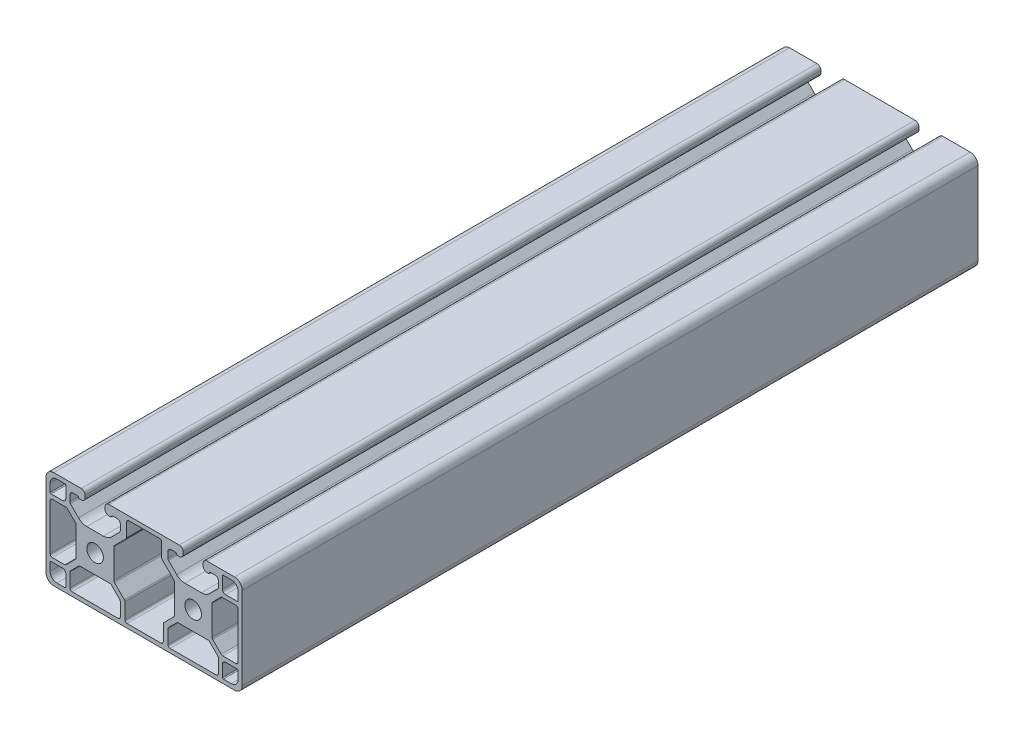
from build123d import *

# Parameters (mm, degrees)
SKETCH1_R      = 3.377777778
EXTRUDE1_DEPTH = 300


with BuildPart() as part:
    # Sketch1 → Extrude1 (new body)
    with BuildSketch(Plane.XY):
        with BuildLine():
            Line((20, -16.825396825), (20, 16.825396825))
            ThreePointArc((20, 16.825396825), (19.070180258, 19.070180258), (16.825396825, 20))
            Line((16.825396825, 20), (5.638095238, 20))
            ThreePointArc((5.638095238, 20), (4.524682656, 19.538809408), (4.063492063, 18.425396825))
            Line((4.063492063, 18.425396825), (4.063492063, 17.511111111))
            ThreePointArc((4.063492063, 17.511111111), (4.524682656, 16.397698529), (5.638095238, 15.936507937))
            Line((5.638095238, 15.936507937), (6.344572699, 15.936507937))
            ThreePointArc((6.344572699, 15.936507937), (6.608509887, 16.043145483), (6.724293748, 16.303200291))
            Line((6.724293748, 16.303200291), (6.72528969, 16.331720344))
            ThreePointArc((6.72528969, 16.331720344), (6.84107355, 16.591775152), (7.105010739, 16.698412698))
            Line((7.105010739, 16.698412698), (9.015873016, 16.698412698))
            ThreePointArc((9.015873016, 16.698412698), (9.913786389, 16.326484802), (10.285714286, 15.428571429))
            Line((10.285714286, 15.428571429), (10.285714286, 12.988478889))
            ThreePointArc((10.285714286, 12.988478889), (10.218051648, 12.648315838), (10.025364758, 12.359939528))
            Line((10.025364758, 12.359939528), (6.738975247, 9.073550017))
            ThreePointArc((6.738975247, 9.073550017), (5.198221819, 8.04405149), (3.380779233, 7.682539683))
            Line((3.380779233, 7.682539683), (-3.380779233, 7.682539683))
            ThreePointArc((-3.380779233, 7.682539683), (-5.198221819, 8.04405149), (-6.738975247, 9.073550017))
            Line((-6.738975247, 9.073550017), (-10.025364758, 12.359939528))
            ThreePointArc((-10.025364758, 12.359939528), (-10.218051648, 12.648315838), (-10.285714286, 12.988478889))
            Line((-10.285714286, 12.988478889), (-10.285714286, 15.428571429))
            ThreePointArc((-10.285714286, 15.428571429), (-9.913786389, 16.326484802), (-9.015873016, 16.698412698))
            Line((-9.015873016, 16.698412698), (-7.105010739, 16.698412698))
            ThreePointArc((-7.105010739, 16.698412698), (-6.84107355, 16.591775152), (-6.72528969, 16.331720344))
            Line((-6.72528969, 16.331720344), (-6.724293748, 16.303200291))
            ThreePointArc((-6.724293748, 16.303200291), (-6.608509887, 16.043145483), (-6.344572699, 15.936507937))
            Line((-6.344572699, 15.936507937), (-5.638095238, 15.936507937))
            ThreePointArc((-5.638095238, 15.936507937), (-4.524682656, 16.397698529), (-4.063492063, 17.511111111))
            Line((-4.063492063, 17.511111111), (-4.063492063, 18.425396825))
            ThreePointArc((-4.063492063, 18.425396825), (-4.524682656, 19.538809408), (-5.638095238, 20))
            Line((-5.638095238, 20), (-34.361904762, 20))
            ThreePointArc((-34.361904762, 20), (-35.475317344, 19.538809408), (-35.936507937, 18.425396825))
            Line((-35.936507937, 18.425396825), (-35.936507937, 17.511111111))
            ThreePointArc((-35.936507937, 17.511111111), (-35.475317344, 16.397698529), (-34.361904762, 15.936507937))
            Line((-34.361904762, 15.936507937), (-33.655427301, 15.936507937))
            ThreePointArc((-33.655427301, 15.936507937), (-33.391490113, 16.043145483), (-33.275706252, 16.303200291))
            Line((-33.275706252, 16.303200291), (-33.27471031, 16.331720344))
            ThreePointArc((-33.27471031, 16.331720344), (-33.15892645, 16.591775152), (-32.894989261, 16.698412698))
            Line((-32.894989261, 16.698412698), (-30.984126984, 16.698412698))
            ThreePointArc((-30.984126984, 16.698412698), (-30.086213611, 16.326484802), (-29.714285714, 15.428571429))
            Line((-29.714285714, 15.428571429), (-29.714285714, 12.988478889))
            ThreePointArc((-29.714285714, 12.988478889), (-29.781948352, 12.648315838), (-29.974635242, 12.359939528))
            Line((-29.974635242, 12.359939528), (-33.261024753, 9.073550017))
            ThreePointArc((-33.261024753, 9.073550017), (-34.801778181, 8.04405149), (-36.619220767, 7.682539683))
            Line((-36.619220767, 7.682539683), (-43.380779233, 7.682539683))
            ThreePointArc((-43.380779233, 7.682539683), (-45.198221819, 8.04405149), (-46.738975247, 9.073550017))
            Line((-46.738975247, 9.073550017), (-50.025364758, 12.359939528))
            ThreePointArc((-50.025364758, 12.359939528), (-50.218051648, 12.648315838), (-50.285714286, 12.988478889))
            Line((-50.285714286, 12.988478889), (-50.285714286, 15.428571429))
            ThreePointArc((-50.285714286, 15.428571429), (-49.913786389, 16.326484802), (-49.015873016, 16.698412698))
            Line((-49.015873016, 16.698412698), (-47.105010739, 16.698412698))
            ThreePointArc((-47.105010739, 16.698412698), (-46.84107355, 16.591775152), (-46.72528969, 16.331720344))
            Line((-46.72528969, 16.331720344), (-46.724293748, 16.303200291))
            ThreePointArc((-46.724293748, 16.303200291), (-46.608509887, 16.043145483), (-46.344572699, 15.936507937))
            Line((-46.344572699, 15.936507937), (-45.638095238, 15.936507937))
            ThreePointArc((-45.638095238, 15.936507937), (-44.524682656, 16.397698529), (-44.063492063, 17.511111111))
            Line((-44.063492063, 17.511111111), (-44.063492063, 18.425396825))
            ThreePointArc((-44.063492063, 18.425396825), (-44.524682656, 19.538809408), (-45.638095238, 20))
            Line((-45.638095238, 20), (-56.825396825, 20))
            ThreePointArc((-56.825396825, 20), (-59.070180258, 19.070180258), (-60, 16.825396825))
            Line((-60, 16.825396825), (-60, -16.825396825))
            ThreePointArc((-60, -16.825396825), (-59.070180258, -19.070180258), (-56.825396825, -20))
            Line((-56.825396825, -20), (16.825396825, -20))
            ThreePointArc((16.825396825, -20), (19.070180258, -19.070180258), (20, -16.825396825))
        make_face()
        Circle(SKETCH1_R, mode=Mode.SUBTRACT)
        with Locations((-40, 0)):
            Circle(SKETCH1_R, mode=Mode.SUBTRACT)
        with BuildLine():
            Line((18.349206349, 15.555555556), (18.314527251, 12.312397841))
            ThreePointArc((18.314527251, 12.312397841), (18.201823251, 12.046360922), (17.934596465, 11.936507937))
            Line((17.934596465, 11.936507937), (13.206349206, 11.936507937))
            ThreePointArc((13.206349206, 11.936507937), (12.308435833, 12.308435833), (11.936507937, 13.206349206))
            Line((11.936507937, 13.206349206), (11.936507937, 17.934596465))
            ThreePointArc((11.936507937, 17.934596465), (12.046360922, 18.201823251), (12.312397841, 18.31452725))
            Line((12.312397841, 18.31452725), (15.555555556, 18.349206349))
            ThreePointArc((15.555555556, 18.349206349), (17.530964976, 17.530964976), (18.349206349, 15.555555556))
        make_face(mode=Mode.SUBTRACT)
        with BuildLine():
            Line((15.555555556, -18.349206349), (12.316460442, -18.349206349))
            ThreePointArc((12.316460442, -18.349206349), (12.047793449, -18.237920837), (11.936507937, -17.969253843))
            Line((11.936507937, -17.969253843), (11.936507937, -13.206349206))
            ThreePointArc((11.936507937, -13.206349206), (12.308435833, -12.308435833), (13.206349206, -11.936507937))
            Line((13.206349206, -11.936507937), (17.934596465, -11.936507937))
            ThreePointArc((17.934596465, -11.936507937), (18.201823251, -12.046360922), (18.314527251, -12.312397841))
            Line((18.314527251, -12.312397841), (18.349206349, -15.555555556))
            ThreePointArc((18.349206349, -15.555555556), (17.530964976, -17.530964976), (15.555555556, -18.349206349))
        make_face(mode=Mode.SUBTRACT)
        with BuildLine():
            Line((-12.565047298, 11.307968575), (-7.94288921, 6.685810488))
            ThreePointArc((-7.94288921, 6.685810488), (-7.75020232, 6.397434178), (-7.682539683, 6.057271127))
            Line((-7.682539683, 6.057271127), (-7.682539683, -5.877688453))
            ThreePointArc((-7.682539683, -5.877688453), (-7.75020232, -6.217851504), (-7.94288921, -6.506227814))
            Line((-7.94288921, -6.506227814), (-11.930126663, -10.493465266))
            ThreePointArc((-11.930126663, -10.493465266), (-12.122813553, -10.781841576), (-12.19047619, -11.122004627))
            Line((-12.19047619, -11.122004627), (-12.19047619, -17.46031746))
            ThreePointArc((-12.19047619, -17.46031746), (-12.450825718, -18.088856821), (-13.079365079, -18.349206349))
            Line((-13.079365079, -18.349206349), (-26.920634921, -18.349206349))
            ThreePointArc((-26.920634921, -18.349206349), (-27.549174282, -18.088856821), (-27.80952381, -17.46031746))
            Line((-27.80952381, -17.46031746), (-27.80952381, -11.122004627))
            ThreePointArc((-27.80952381, -11.122004627), (-27.877186447, -10.781841576), (-28.069873337, -10.493465266))
            Line((-28.069873337, -10.493465266), (-32.05711079, -6.506227814))
            ThreePointArc((-32.05711079, -6.506227814), (-32.24979768, -6.217851504), (-32.317460317, -5.877688453))
            Line((-32.317460317, -5.877688453), (-32.317460317, 6.057271127))
            ThreePointArc((-32.317460317, 6.057271127), (-32.24979768, 6.397434178), (-32.05711079, 6.685810488))
            Line((-32.05711079, 6.685810488), (-27.434952702, 11.307968575))
            ThreePointArc((-27.434952702, 11.307968575), (-27.242265812, 11.596344886), (-27.174603175, 11.936507937))
            Line((-27.174603175, 11.936507937), (-27.174603175, 17.421618969))
            ThreePointArc((-27.174603175, 17.421618969), (-26.914253647, 18.05015833), (-26.285714286, 18.310507858))
            Line((-26.285714286, 18.310507858), (-13.714285714, 18.310507858))
            ThreePointArc((-13.714285714, 18.310507858), (-13.085746353, 18.05015833), (-12.825396825, 17.421618969))
            Line((-12.825396825, 17.421618969), (-12.825396825, 11.936507937))
            ThreePointArc((-12.825396825, 11.936507937), (-12.757734188, 11.596344886), (-12.565047298, 11.307968575))
        make_face(mode=Mode.SUBTRACT)
        with BuildLine():
            Line((-51.28244348, 10.025364758), (-47.94288921, 6.685810488))
            ThreePointArc((-47.94288921, 6.685810488), (-47.75020232, 6.397434178), (-47.682539683, 6.057271127))
            Line((-47.682539683, 6.057271127), (-47.682539683, -5.518523103))
            ThreePointArc((-47.682539683, -5.518523103), (-47.75020232, -5.858686154), (-47.94288921, -6.147062465))
            Line((-47.94288921, -6.147062465), (-51.821191504, -10.025364758))
            ThreePointArc((-51.821191504, -10.025364758), (-52.109567814, -10.218051648), (-52.449730865, -10.285714286))
            Line((-52.449730865, -10.285714286), (-57.421618969, -10.285714286))
            ThreePointArc((-57.421618969, -10.285714286), (-58.05015833, -10.025364758), (-58.310507858, -9.396825397))
            Line((-58.310507858, -9.396825397), (-58.310507858, 9.396825397))
            ThreePointArc((-58.310507858, 9.396825397), (-58.05015833, 10.025364758), (-57.421618969, 10.285714286))
            Line((-57.421618969, 10.285714286), (-51.910982841, 10.285714286))
            ThreePointArc((-51.910982841, 10.285714286), (-51.57081979, 10.218051648), (-51.28244348, 10.025364758))
        make_face(mode=Mode.SUBTRACT)
        with BuildLine():
            Line((-58.314527251, 12.312397841), (-58.349206349, 15.555555556))
            ThreePointArc((-58.349206349, 15.555555556), (-57.530964976, 17.530964976), (-55.555555556, 18.349206349))
            Line((-55.555555556, 18.349206349), (-52.312397841, 18.31452725))
            ThreePointArc((-52.312397841, 18.31452725), (-52.046360922, 18.201823251), (-51.936507937, 17.934596465))
            Line((-51.936507937, 17.934596465), (-51.936507937, 13.206349206))
            ThreePointArc((-51.936507937, 13.206349206), (-52.308435833, 12.308435833), (-53.206349206, 11.936507937))
            Line((-53.206349206, 11.936507937), (-57.934596465, 11.936507937))
            ThreePointArc((-57.934596465, 11.936507937), (-58.201823251, 12.046360922), (-58.314527251, 12.312397841))
        make_face(mode=Mode.SUBTRACT)
        with BuildLine():
            Line((-52.316460442, -18.349206349), (-55.555555556, -18.349206349))
            ThreePointArc((-55.555555556, -18.349206349), (-57.530964976, -17.530964976), (-58.349206349, -15.555555556))
            Line((-58.349206349, -15.555555556), (-58.314527251, -12.312397841))
            ThreePointArc((-58.314527251, -12.312397841), (-58.201823251, -12.046360922), (-57.934596465, -11.936507937))
            Line((-57.934596465, -11.936507937), (-53.206349206, -11.936507937))
            ThreePointArc((-53.206349206, -11.936507937), (-52.308435833, -12.308435833), (-51.936507937, -13.206349206))
            Line((-51.936507937, -13.206349206), (-51.936507937, -17.969253843))
            ThreePointArc((-51.936507937, -17.969253843), (-52.047793449, -18.237920837), (-52.316460442, -18.349206349))
        make_face(mode=Mode.SUBTRACT)
        with BuildLine():
            Line((-46.057271127, -7.682539683), (-33.942728873, -7.682539683))
            ThreePointArc((-33.942728873, -7.682539683), (-33.602565822, -7.75020232), (-33.314189512, -7.94288921))
            Line((-33.314189512, -7.94288921), (-29.974635242, -11.28244348))
            ThreePointArc((-29.974635242, -11.28244348), (-29.781948352, -11.57081979), (-29.714285714, -11.910982841))
            Line((-29.714285714, -11.910982841), (-29.714285714, -17.46031746))
            ThreePointArc((-29.714285714, -17.46031746), (-29.974635242, -18.088856821), (-30.603174603, -18.349206349))
            Line((-30.603174603, -18.349206349), (-49.396825397, -18.349206349))
            ThreePointArc((-49.396825397, -18.349206349), (-50.025364758, -18.088856821), (-50.285714286, -17.46031746))
            Line((-50.285714286, -17.46031746), (-50.285714286, -11.910982841))
            ThreePointArc((-50.285714286, -11.910982841), (-50.218051648, -11.57081979), (-50.025364758, -11.28244348))
            Line((-50.025364758, -11.28244348), (-46.685810488, -7.94288921))
            ThreePointArc((-46.685810488, -7.94288921), (-46.397434178, -7.75020232), (-46.057271127, -7.682539683))
        make_face(mode=Mode.SUBTRACT)
        with BuildLine():
            Line((10.285714286, -11.911028865), (10.285714286, -17.46031746))
            ThreePointArc((10.285714286, -17.46031746), (10.025364758, -18.088856821), (9.396825397, -18.349206349))
            Line((9.396825397, -18.349206349), (-9.396825397, -18.349206349))
            ThreePointArc((-9.396825397, -18.349206349), (-10.025364758, -18.088856821), (-10.285714286, -17.46031746))
            Line((-10.285714286, -17.46031746), (-10.285714286, -11.910982841))
            ThreePointArc((-10.285714286, -11.910982841), (-10.218051648, -11.57081979), (-10.025364758, -11.28244348))
            Line((-10.025364758, -11.28244348), (-6.685810488, -7.94288921))
            ThreePointArc((-6.685810488, -7.94288921), (-6.397434178, -7.75020232), (-6.057271127, -7.682539683))
            Line((-6.057271127, -7.682539683), (6.057225103, -7.682539683))
            ThreePointArc((6.057225103, -7.682539683), (6.397430675, -7.750210778), (6.685843032, -7.942921754))
            Line((6.685843032, -7.942921754), (10.025332214, -11.282410936))
            ThreePointArc((10.025332214, -11.282410936), (10.21804319, -11.570823293), (10.285714286, -11.911028865))
        make_face(mode=Mode.SUBTRACT)
        with BuildLine():
            Line((11.461993611, -10.025332214), (7.942921754, -6.506260357))
            ThreePointArc((7.942921754, -6.506260357), (7.750210778, -6.217848), (7.682539683, -5.877642429))
            Line((7.682539683, -5.877642429), (7.682539683, 6.057271127))
            ThreePointArc((7.682539683, 6.057271127), (7.75020232, 6.397434178), (7.94288921, 6.685810488))
            Line((7.94288921, 6.685810488), (11.28244348, 10.025364758))
            ThreePointArc((11.28244348, 10.025364758), (11.57081979, 10.218051648), (11.910982841, 10.285714286))
            Line((11.910982841, 10.285714286), (17.421618969, 10.285714286))
            ThreePointArc((17.421618969, 10.285714286), (18.05015833, 10.025364758), (18.310507858, 9.396825397))
            Line((18.310507858, 9.396825397), (18.310507858, -9.396825397))
            ThreePointArc((18.310507858, -9.396825397), (18.05015833, -10.025364758), (17.421618969, -10.285714286))
            Line((17.421618969, -10.285714286), (12.090611539, -10.285714286))
            ThreePointArc((12.090611539, -10.285714286), (11.750405968, -10.21804319), (11.461993611, -10.025332214))
        make_face(mode=Mode.SUBTRACT)
    extrude(amount=-EXTRUDE1_DEPTH)


solid = part.part
